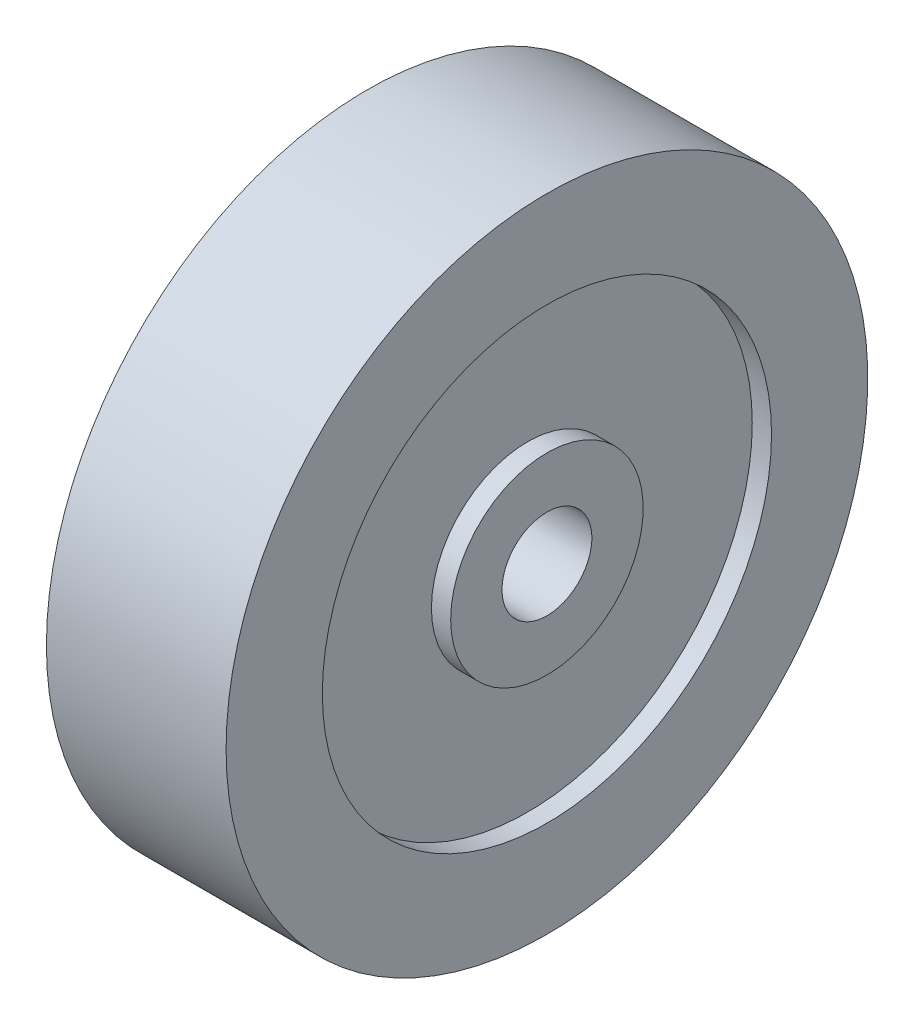
from build123d import *


with BuildPart() as part:
    # Sketch1 → Revolve1 (revolve)
    with BuildSketch(Plane.XY, mode=Mode.PRIVATE) as revolve1_sk:
        Polygon((0, 0), (28, 0), (28, 15), (25, 15), (25, 35), (28, 35), (28, 43), (0, 43), (0, 35), (3, 35), (3, 15), (0, 15), align=None)
    revolve(revolve1_sk.sketch.rotate(Axis((-31.940740741, 50, 0), (1, 0, 0)), 270), axis=Axis((-31.940740741, 50, 0), (1, 0, 0)))


solid = part.part
